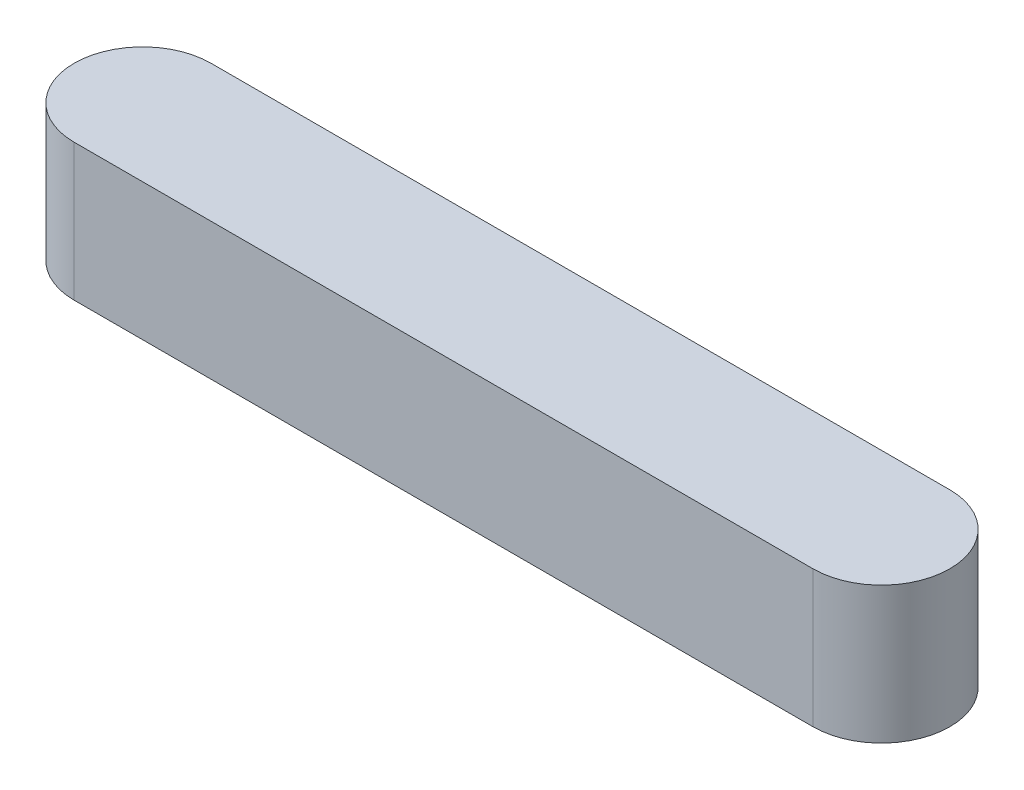
from build123d import *

# Parameters (mm, degrees)
EXTRUDE_1_DEPTH = 5


with BuildPart() as part:
    # Эскиз1 → Бобышка-Вытянуть1 (new body)
    with BuildSketch(Plane(origin=(0, 0, 0), x_dir=(1, 0, 0), z_dir=(0, 1, 0))):
        with BuildLine():
            Line((0, 2.5), (27, 2.5))
            ThreePointArc((27, 2.5), (29.5, 0), (27, -2.5))
            Line((27, -2.5), (0, -2.5))
            ThreePointArc((0, -2.5), (-2.5, 0), (0, 2.5))
        make_face()
    extrude(amount=EXTRUDE_1_DEPTH)


solid = part.part
